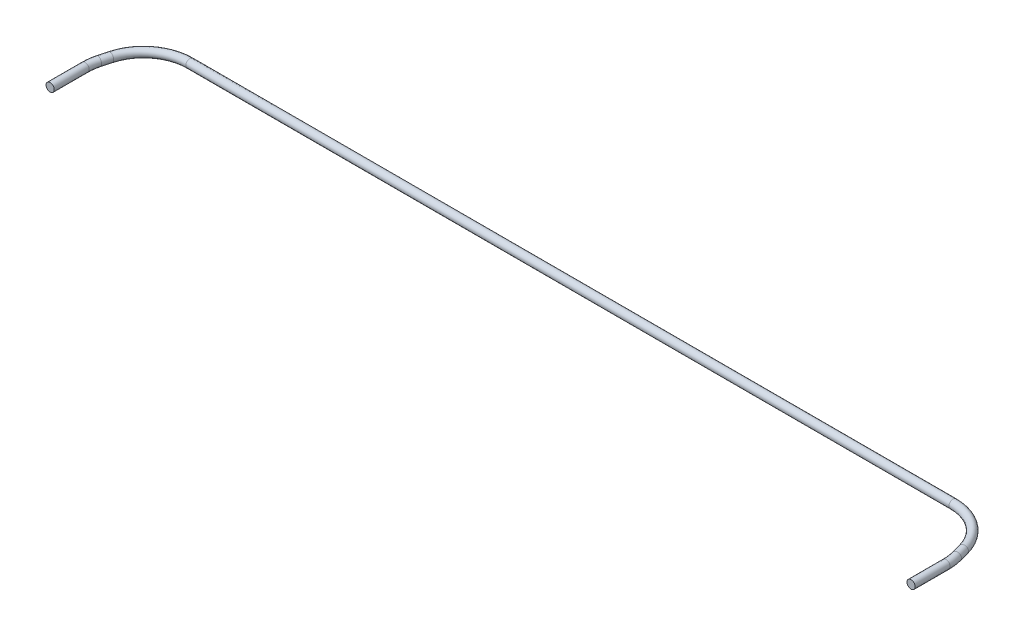
from build123d import *

# Parameters (mm, degrees)
SKETCH2_R = 1.29413


with BuildPart() as part:
    # Sweep1: sweep along a path in Sketch1
    with BuildLine(Plane(origin=(0, 0, 0), x_dir=(1, 0, 0), z_dir=(0, 1, 0))) as sweep1_path:
        Line((0, 2.58826), (120, 2.58826))
        ThreePointArc((120, 2.58826), (128.880770004, -0.4263552), (134.091177095, -8.224280477))
        Line((134.091177095, -8.224280477), (134.895024672, -11.224280477))
        ThreePointArc((134.895024672, -11.224280477), (135.267302991, -13.095849971), (135.392107577, -15))
        Line((135.392107577, -15), (135.392107577, -26))
    # Sketch2 → Sweep1 (sweep)
    with BuildSketch(Plane(origin=(0, 0, 0), x_dir=(0, 0, -1), z_dir=(1, 0, 0))):
        with Locations((2.58826, 0)):
            Circle(SKETCH2_R)
    sweep1 = sweep(path=sweep1_path.line)

    # Mirror1: Sweep1 across plane
    add(sweep1.mirror(Plane(origin=(0, 0, 0), x_dir=(0, 0, 1), z_dir=(1, 0, 0))))


solid = part.part
